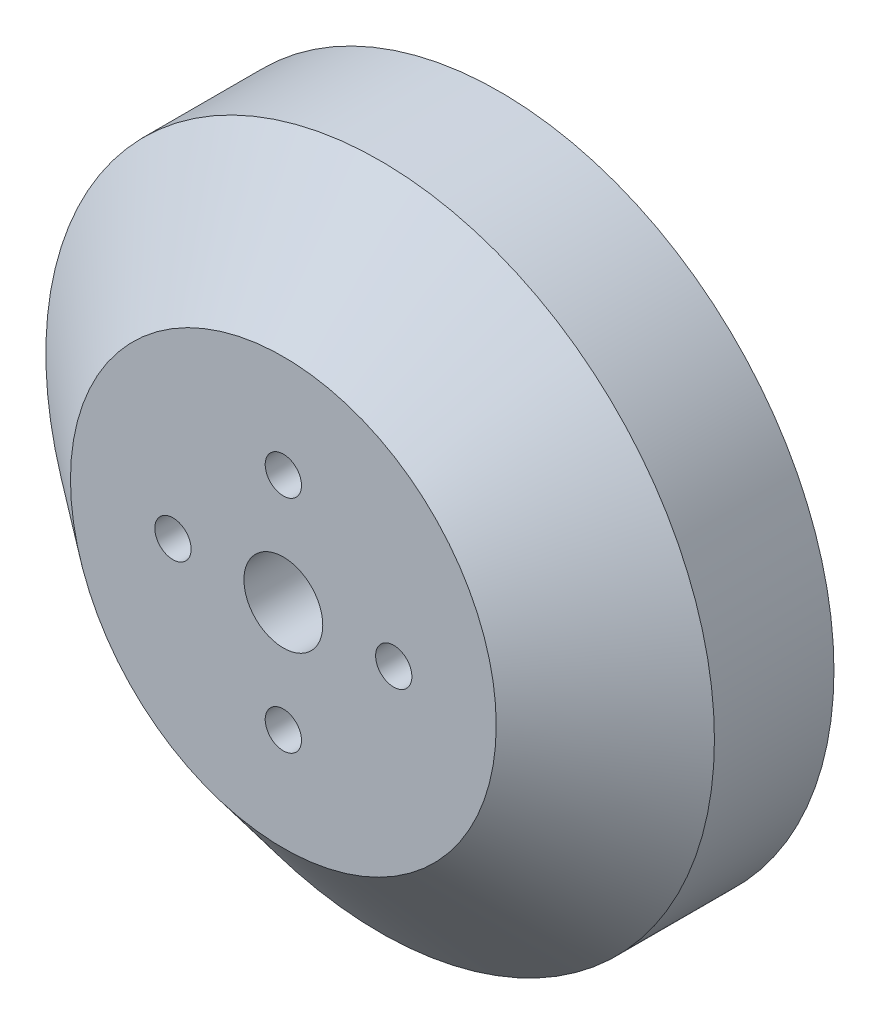
from build123d import *

# Parameters (mm, degrees)
SKETCH_1_R      = 13.5
SKETCH_1_R_2    = 1.15
SKETCH_1_R_3    = 2.5
EXTRUDE_1_DEPTH = 7


with BuildPart() as part:
    # 草图1 → 凸台-拉伸1 (new body)
    with BuildSketch(Plane.XY):
        Circle(SKETCH_1_R)
        with Locations((0, 7)):
            Circle(SKETCH_1_R_2, mode=Mode.SUBTRACT)
        with Locations((0, -7)):
            Circle(SKETCH_1_R_2, mode=Mode.SUBTRACT)
        with Locations((7, 0)):
            Circle(SKETCH_1_R_2, mode=Mode.SUBTRACT)
        with Locations((-7, 0)):
            Circle(SKETCH_1_R_2, mode=Mode.SUBTRACT)
        Circle(SKETCH_1_R_3, mode=Mode.SUBTRACT)
    extrude(amount=EXTRUDE_1_DEPTH)

    # 草图2 → 旋转1 (revolve)
    with BuildSketch(Plane(origin=(0, 0, 0), x_dir=(0, 0, -1), z_dir=(1, 0, 0)), mode=Mode.PRIVATE) as revolve_1_sk:
        Polygon((-7, 13.5), (-0.861872247, 21.199331537), (6.717890827, 21.199331537), (6.717890827, 19.5), (4.783371951, 19.5), (0, 13.5), align=None)
    revolve(revolve_1_sk.sketch.rotate(Axis((0, 0, 0), (0, 0, -1)), 90), axis=Axis((0, 0, 0), (0, 0, -1)))


solid = part.part
